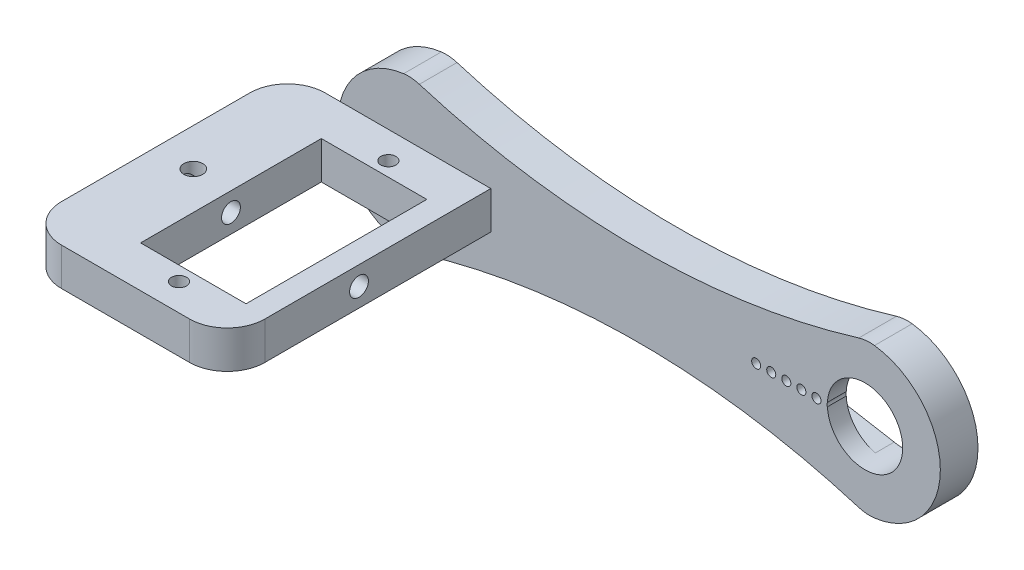
from build123d import *

# Parameters (mm, degrees)
SKETCH1_R           = 5
BOSS_EXTRUDE1_DEPTH = 5
FILLET1_R           = 5
SKETCH2_R           = 0.6
CUT_EXTRUDE1_DEPTH  = 5
SKETCH3_R           = 0.6
CUT_EXTRUDE2_DEPTH  = 2.5
BOSS_EXTRUDE7_REACH = 72.882
BOSS_EXTRUDE8_DEPTH = 35
SKETCH13_R          = 1
SKETCH13_W          = 14
SKETCH13_H          = 24
CUT_EXTRUDE3_DEPTH  = 82.57977968
SKETCH14_W          = 10
SKETCH14_H          = 35
BOSS_EXTRUDE9_DEPTH = 5
SKETCH15_R          = 1.25
CUT_EXTRUDE4_DEPTH  = 5
SKETCH16_R          = 1.25
CUT_EXTRUDE5_DEPTH  = 96.984672029
FILLET2_R           = 5


with BuildPart() as part:
    # Sketch1 → Boss-Extrude1 (new body)
    with BuildSketch(Plane.XY):
        with BuildLine():
            ThreePointArc((0, 10), (-10, 0), (0, -10))
            ThreePointArc((0, -10), (30, -5.393920142), (60, -10))
            ThreePointArc((60, -10), (70, 0), (60, 10))
            ThreePointArc((60, 10), (30, 5.393920142), (0, 10))
        make_face()
        Circle(SKETCH1_R, mode=Mode.SUBTRACT)
        with Locations((60, 0)):
            Circle(SKETCH1_R, mode=Mode.SUBTRACT)
    extrude(amount=BOSS_EXTRUDE1_DEPTH)

    # Fillet1
    fillet1_edges = [part.edges().sort_by_distance(p)[0] for p in [
        (60, 10, 2.5),
        (60, -10, 2.5),
        (0, -10, 2.5),
        (0, 10, 2.5),
    ]]
    fillet(fillet1_edges, radius=FILLET1_R)

    # Sketch2 → Cut-Extrude1 (cut)
    with BuildSketch(Plane(origin=(0, 0, 0), x_dir=(-1, 0, 0), z_dir=(0, 0, -1))):
        with Locations((-4.45, 0)):
            Circle(SKETCH2_R)
        with Locations((-6.45, 0)):
            Circle(SKETCH2_R)
        with Locations((-8.45, 0)):
            Circle(SKETCH2_R)
        with Locations((-10.45, 0)):
            Circle(SKETCH2_R)
        with Locations((-12.45, 0)):
            Circle(SKETCH2_R)
        with Locations((-14.45, 0)):
            Circle(SKETCH2_R)
    cut_extrude1 = extrude(amount=-CUT_EXTRUDE1_DEPTH, mode=Mode.SUBTRACT)

    # Sketch3 → Cut-Extrude2 (cut)
    with BuildSketch(Plane(origin=(0, 0, 0), x_dir=(-1, 0, 0), z_dir=(0, 0, -1))):
        with BuildLine():
            Line((-15.012283737, -2.435946838), (-1.124567474, -4.871893677))
            ThreePointArc((-1.124567474, -4.871893677), (-3.832599709, -3.211102532), (-4.993539326, -0.254096441))
            ThreePointArc((-4.993539326, -0.254096441), (-5.05, 0), (-4.993539326, 0.254096441))
            ThreePointArc((-4.993539326, 0.254096441), (-3.746221254, 3.311468906), (-0.865051903, 4.924600005))
            Line((-0.865051903, 4.924600005), (-14.882525952, 2.462300002))
            ThreePointArc((-14.882525952, 2.462300002), (-16.949123268, 0.066203422), (-15.012283737, -2.435946838))
        make_face()
        with Locations((-12.45, 0)):
            Circle(SKETCH3_R, mode=Mode.SUBTRACT)
        with Locations((-6.45, 0)):
            Circle(SKETCH3_R, mode=Mode.SUBTRACT)
        with Locations((-8.45, 0)):
            Circle(SKETCH3_R, mode=Mode.SUBTRACT)
        with Locations((-10.45, 0)):
            Circle(SKETCH3_R, mode=Mode.SUBTRACT)
        with Locations((-14.45, 0)):
            Circle(SKETCH3_R, mode=Mode.SUBTRACT)
    cut_extrude2 = extrude(amount=-CUT_EXTRUDE2_DEPTH, mode=Mode.SUBTRACT)

    # Mirror2: Cut-Extrude1, Cut-Extrude2 across plane
    add(cut_extrude1.mirror(Plane(origin=(30, 0, 0), x_dir=(0, 0, 1), z_dir=(1, 0, 0))), mode=Mode.SUBTRACT)
    add(cut_extrude2.mirror(Plane(origin=(30, 0, 0), x_dir=(0, 0, 1), z_dir=(1, 0, 0))), mode=Mode.SUBTRACT)

    # Boss-Extrude7: up to this face of the body (flat: up to its plane)
    boss_extrude7_end = Plane(part.part.faces().sort_by_distance((30, 0, 5))[0])
    # Sketch11 → Boss-Extrude7 (add, up to the picked face)
    with BuildSketch(Plane(origin=(0, 0, 0), x_dir=(-1, 0, 0), z_dir=(0, 0, -1)), mode=Mode.PRIVATE) as boss_extrude7_sk1:
        with BuildLine():
            ThreePointArc((-14.882525952, 2.462300002), (-16.949123268, 0.066203422), (-15.012283737, -2.435946838))
            Line((-15.012283737, -2.435946838), (0, -5))
            ThreePointArc((0, -5), (4.981114334, 0.434165854), (-0.865051903, 4.924600005))
            Line((-0.865051903, 4.924600005), (-14.882525952, 2.462300002))
        make_face()
    boss_extrude7_tool1 = split(extrude(boss_extrude7_sk1.sketch, amount=-BOSS_EXTRUDE7_REACH, mode=Mode.PRIVATE), bisect_by=boss_extrude7_end, keep=Keep.BOTH, mode=Mode.PRIVATE)
    add(boss_extrude7_tool1.solids().sort_by(Axis((4.874327, 0.014975, 0), (0, 0, 1)))[0])

    # Sketch12 → Boss-Extrude8 (add)
    with BuildSketch(Plane.XY.offset(5)):
        with BuildLine():
            ThreePointArc((-9.682458366, 2.5), (-10, 0), (-9.682458366, -2.5))
            Line((-9.682458366, -2.5), (10.317541634, -2.5))
            Line((10.317541634, -2.5), (10.317541634, 2.5))
            Line((10.317541634, 2.5), (-9.682458366, 2.5))
        make_face()
    extrude(amount=BOSS_EXTRUDE8_DEPTH)

    # Sketch13 → Cut-Extrude3 (cut, through all)
    with BuildSketch(Plane(origin=(0, 2.5, 0), x_dir=(1, 0, 0), z_dir=(0, 1, 0))):
        with Locations(Location((0.317541634, -8.6, 0), (0, 0, 270))):
            Circle(SKETCH13_R)
        with Locations(Location((0.317541634, -36.4, 0), (0, 0, 270))):
            Circle(SKETCH13_R)
        with Locations((0.317541634, -22.5)):
            Rectangle(SKETCH13_W, SKETCH13_H)
    extrude(amount=-CUT_EXTRUDE3_DEPTH, mode=Mode.SUBTRACT)

    # Sketch14 → Boss-Extrude9 (add)
    with BuildSketch(Plane(origin=(0, 2.5, 0), x_dir=(1, 0, 0), z_dir=(0, 1, 0))):
        with Locations((-11.682458366, -22.5)):
            Rectangle(SKETCH14_W, SKETCH14_H)
    extrude(amount=-BOSS_EXTRUDE9_DEPTH)

    # Sketch15 → Cut-Extrude4 (cut)
    with BuildSketch(Plane(origin=(0, 2.5, 0), x_dir=(1, 0, 0), z_dir=(0, 1, 0))):
        with Locations(Location((-11.682458366, -22.5, 0), (0, 0, 270))):
            Circle(SKETCH15_R)
    extrude(amount=-CUT_EXTRUDE4_DEPTH, mode=Mode.SUBTRACT)

    # Sketch16 → Cut-Extrude5 (cut, through all)
    with BuildSketch(Plane.ZY.offset(16.682458366)):
        with Locations((22.5, 0)):
            Circle(SKETCH16_R)
    extrude(amount=-CUT_EXTRUDE5_DEPTH, mode=Mode.SUBTRACT)

    # Fillet2
    fillet2_edges = [part.edges().sort_by_distance(p)[0] for p in [
        (10.317541634, 0, 40),
        (-16.682458366, 0, 5),
        (-16.682458366, 0, 40),
    ]]
    fillet(fillet2_edges, radius=FILLET2_R)


solid = part.part
